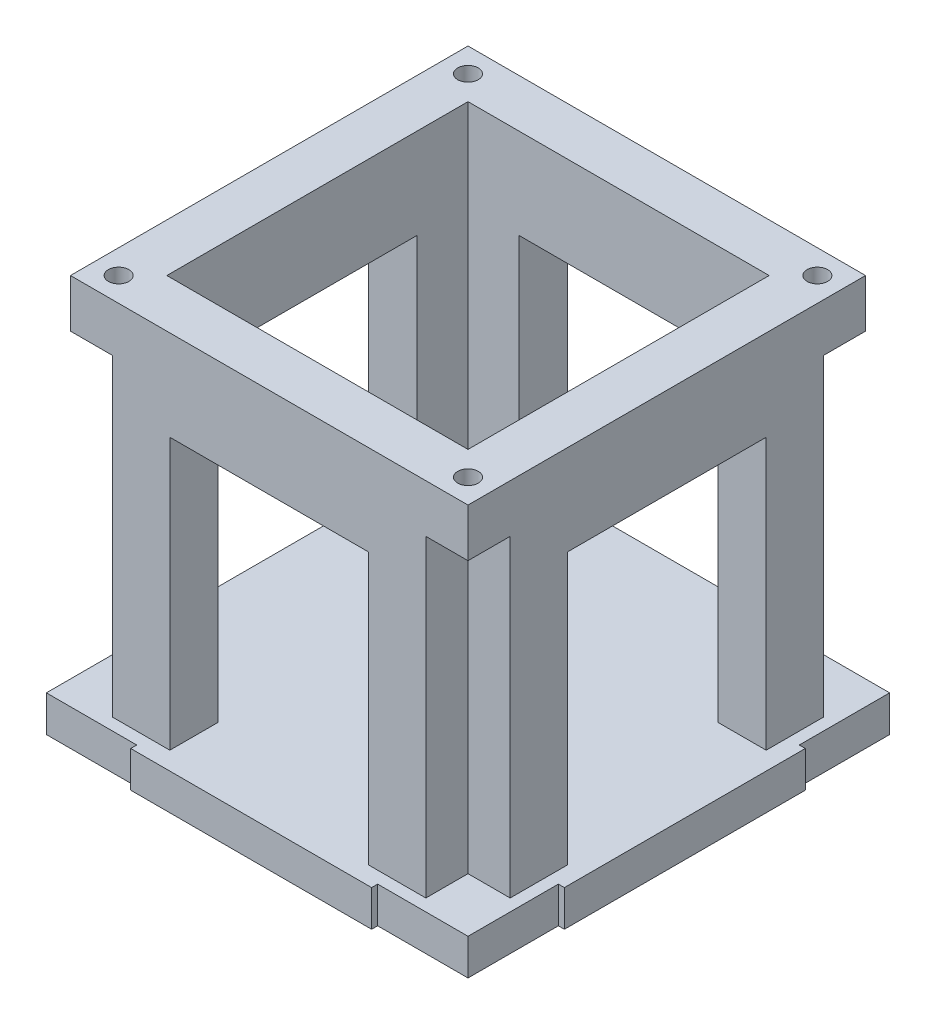
from build123d import *

# Parameters (mm, degrees)
BOSS_EXTRUDE1_DEPTH = 6
SKETCH2_W           = 66
SKETCH2_H           = 66
SKETCH2_R           = 1.705
SKETCH2_W_2         = 50
SKETCH2_H_2         = 50
BOSS_EXTRUDE2_DEPTH = 60
SKETCH4_W           = 7
SKETCH4_H           = 7
CUT_EXTRUDE2_DEPTH  = 52
SKETCH5_W           = 33
SKETCH5_H           = 8
SKETCH5_W_2         = 8
SKETCH5_H_2         = 33
CUT_EXTRUDE3_DEPTH  = 45


with BuildPart() as part:
    # Sketch1 → Boss-Extrude1 (new body)
    with BuildSketch(Plane(origin=(0, 0, 0), x_dir=(1, 0, 0), z_dir=(0, 1, 0))):
        Polygon((-20, 36), (20, 36), (20, 35), (35, 35), (35, 20), (36, 20), (36, -20), (35, -20), (35, -35), (20, -35), (20, -36), (-20, -36), (-20, -35), (-35, -35), (-35, -20), (-36, -20), (-36, 20), (-35, 20), (-35, 35), (-20, 35), align=None)
    extrude(amount=-BOSS_EXTRUDE1_DEPTH)

    # Sketch2 → Boss-Extrude2 (add)
    with BuildSketch(Plane(origin=(0, 0, 0), x_dir=(1, 0, 0), z_dir=(0, 1, 0))):
        Rectangle(SKETCH2_W, SKETCH2_H)
        with Locations(Location((29, 29, 0), (0, 0, 270))):
            Circle(SKETCH2_R, mode=Mode.SUBTRACT)
        with Locations(Location((-29, 29, 0), (0, 0, 270))):
            Circle(SKETCH2_R, mode=Mode.SUBTRACT)
        with Locations(Location((29, -29, 0), (0, 0, 270))):
            Circle(SKETCH2_R, mode=Mode.SUBTRACT)
        with Locations(Location((-29, -29, 0), (0, 0, 270))):
            Circle(SKETCH2_R, mode=Mode.SUBTRACT)
        Rectangle(SKETCH2_W_2, SKETCH2_H_2, mode=Mode.SUBTRACT)
    extrude(amount=BOSS_EXTRUDE2_DEPTH)

    # Sketch4 → Cut-Extrude2 (cut)
    with BuildSketch(Plane(origin=(0, 0, 0), x_dir=(1, 0, 0), z_dir=(0, 1, 0))):
        with Locations((-29.5, 29.5)):
            Rectangle(SKETCH4_W, SKETCH4_H)
        with Locations((29.5, 29.5)):
            Rectangle(SKETCH4_W, SKETCH4_H)
        with Locations((29.5, -29.5)):
            Rectangle(SKETCH4_W, SKETCH4_H)
        with Locations((-29.5, -29.5)):
            Rectangle(SKETCH4_W, SKETCH4_H)
    extrude(amount=CUT_EXTRUDE2_DEPTH, mode=Mode.SUBTRACT)

    # Sketch5 → Cut-Extrude3 (cut)
    with BuildSketch(Plane(origin=(0, 0, 0), x_dir=(1, 0, 0), z_dir=(0, 1, 0))):
        with Locations((0, 29)):
            Rectangle(SKETCH5_W, SKETCH5_H)
        with Locations((0, -29)):
            Rectangle(SKETCH5_W, SKETCH5_H)
        with Locations((29, 0)):
            Rectangle(SKETCH5_W_2, SKETCH5_H_2)
        with Locations((-29, 0)):
            Rectangle(SKETCH5_W_2, SKETCH5_H_2)
    extrude(amount=CUT_EXTRUDE3_DEPTH, mode=Mode.SUBTRACT)


solid = part.part
